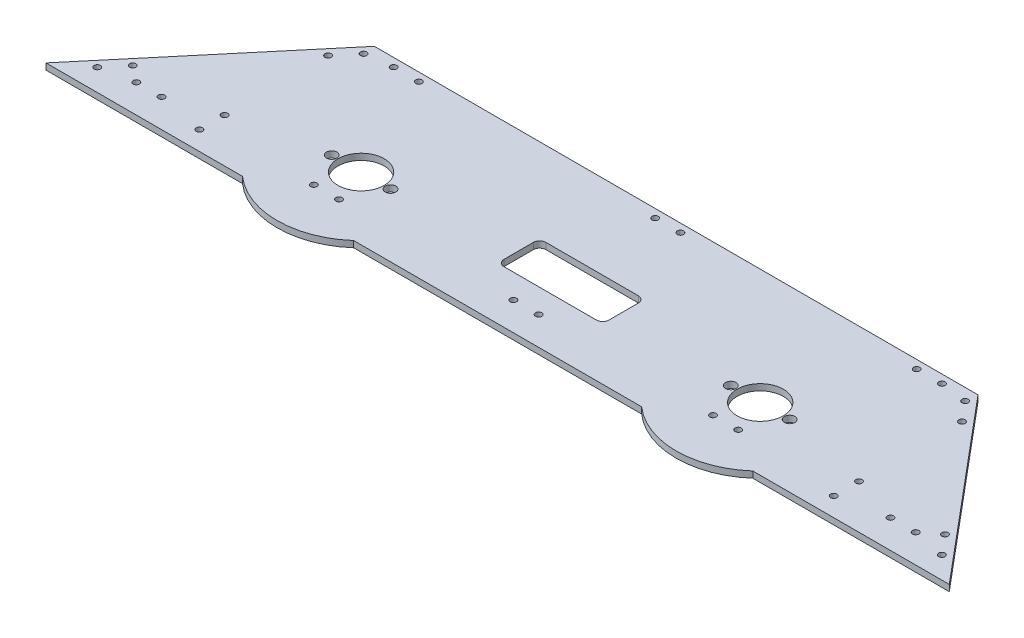
from build123d import *

# Parameters (mm, degrees)
SKETCH_1_R          = 11
SKETCH_1_R_2        = 2.5
EXTRUDE_1_DEPTH     = 3
SKETCH_2_R          = 1.5
CUT_EXTRUDE_2_DEPTH = 439.330925215
SKETCH_3_W          = 50
SKETCH_3_H          = 20
CUT_EXTRUDE_3_DEPTH = 439.330925215
FILLET_1_R          = 3


with BuildPart() as part:
    # 草图1 → 凸台-拉伸1 (new body)
    with BuildSketch(Plane(origin=(0, 0, 0), x_dir=(1, 0, 0), z_dir=(0, 1, 0))):
        with BuildLine():
            Line((0, 0), (71.32346865, 85))
            Line((71.32346865, 85), (358.67653135, 85))
            Line((358.67653135, 85), (430, 0))
            Line((430, 0), (336.457513111, 0))
            ThreePointArc((336.457513111, 0), (310, -10), (283.542486889, 0))
            Line((283.542486889, 0), (146.457513111, 0))
            ThreePointArc((146.457513111, 0), (120, -10), (93.542486889, 0))
            Line((93.542486889, 0), (0, 0))
        make_face()
        with Locations(Location((120, 30, 0), (0, 0, 270))):
            Circle(SKETCH_1_R, mode=Mode.SUBTRACT)
        with Locations(Location((310, 30, 0), (0, 0, 90))):
            Circle(SKETCH_1_R, mode=Mode.SUBTRACT)
        with Locations(Location((106, 30, 0), (0, 0, 270))):
            Circle(SKETCH_1_R_2, mode=Mode.SUBTRACT)
        with Locations(Location((134, 30, 0), (0, 0, 270))):
            Circle(SKETCH_1_R_2, mode=Mode.SUBTRACT)
        with Locations(Location((324, 30, 0), (0, 0, 90))):
            Circle(SKETCH_1_R_2, mode=Mode.SUBTRACT)
        with Locations(Location((296, 30, 0), (0, 0, 90))):
            Circle(SKETCH_1_R_2, mode=Mode.SUBTRACT)
    extrude(amount=EXTRUDE_1_DEPTH)

    # 草图2 → 切除-拉伸2 (cut, through all)
    with BuildSketch(Plane(origin=(0, 3, 0), x_dir=(1, 0, 0), z_dir=(0, 1, 0))):
        with Locations(Location((221, 13.5, 0), (0, 0, 270))):
            Circle(SKETCH_2_R)
        with Locations(Location((304, 13.5, 0), (0, 0, 270))):
            Circle(SKETCH_2_R)
        with Locations(Location((316, 13.5, 0), (0, 0, 270))):
            Circle(SKETCH_2_R)
        with Locations(Location((388.5, 13.5, 0), (0, 0, 270))):
            Circle(SKETCH_2_R)
        with Locations(Location((400.5, 13.5, 0), (0, 0, 270))):
            Circle(SKETCH_2_R)
        with Locations(Location((366, 9, 0), (0, 0, 270))):
            Circle(SKETCH_2_R)
        with Locations(Location((366, 21, 0), (0, 0, 270))):
            Circle(SKETCH_2_R)
        with Locations(Location((221, 81, 0), (0, 0, 270))):
            Circle(SKETCH_2_R)
        with Locations(Location((333.5, 81, 0), (0, 0, 270))):
            Circle(SKETCH_2_R)
        with Locations(Location((345.5, 81, 0), (0, 0, 270))):
            Circle(SKETCH_2_R)
        with Locations(Location((358.183504016, 79.364671789, 0), (0, 0, 270))):
            Circle(SKETCH_2_R)
        with Locations(Location((365.896955332, 70.172138471, 0), (0, 0, 270))):
            Circle(SKETCH_2_R)
        with Locations(Location((408.320937572, 19.613205225, 0), (0, 0, 270))):
            Circle(SKETCH_2_R)
        with Locations(Location((416.034388888, 10.420671908, 0), (0, 0, 270))):
            Circle(SKETCH_2_R)
        with Locations(Location((209, 81, 0), (0, 0, 90))):
            Circle(SKETCH_2_R)
        with Locations(Location((96.5, 81, 0), (0, 0, 90))):
            Circle(SKETCH_2_R)
        with Locations(Location((84.5, 81, 0), (0, 0, 90))):
            Circle(SKETCH_2_R)
        with Locations(Location((71.816495984, 79.364671789, 0), (0, 0, 90))):
            Circle(SKETCH_2_R)
        with Locations(Location((64.103044668, 70.172138471, 0), (0, 0, 90))):
            Circle(SKETCH_2_R)
        with Locations(Location((21.679062428, 19.613205225, 0), (0, 0, 90))):
            Circle(SKETCH_2_R)
        with Locations(Location((13.965611112, 10.420671908, 0), (0, 0, 90))):
            Circle(SKETCH_2_R)
        with Locations(Location((29.5, 13.5, 0), (0, 0, 90))):
            Circle(SKETCH_2_R)
        with Locations(Location((41.5, 13.5, 0), (0, 0, 90))):
            Circle(SKETCH_2_R)
        with Locations(Location((64, 21, 0), (0, 0, 90))):
            Circle(SKETCH_2_R)
        with Locations(Location((64, 9, 0), (0, 0, 90))):
            Circle(SKETCH_2_R)
        with Locations(Location((114, 13.5, 0), (0, 0, 90))):
            Circle(SKETCH_2_R)
        with Locations(Location((126, 13.5, 0), (0, 0, 90))):
            Circle(SKETCH_2_R)
        with Locations(Location((209, 13.5, 0), (0, 0, 90))):
            Circle(SKETCH_2_R)
    extrude(amount=-CUT_EXTRUDE_2_DEPTH, mode=Mode.SUBTRACT)

    # 草图3 → 切除-拉伸3 (cut, through all)
    with BuildSketch(Plane(origin=(0, 3, 0), x_dir=(1, 0, 0), z_dir=(0, 1, 0))):
        with Locations((215, 35)):
            Rectangle(SKETCH_3_W, SKETCH_3_H)
    extrude(amount=-CUT_EXTRUDE_3_DEPTH, mode=Mode.SUBTRACT)

    # 圆角1
    fillet_1_edges = [part.edges().sort_by_distance(p)[0] for p in [
        (190, 1.5, -25),
        (190, 1.5, -45),
        (240, 1.5, -45),
        (240, 1.5, -25),
    ]]
    fillet(fillet_1_edges, radius=FILLET_1_R)


solid = part.part
